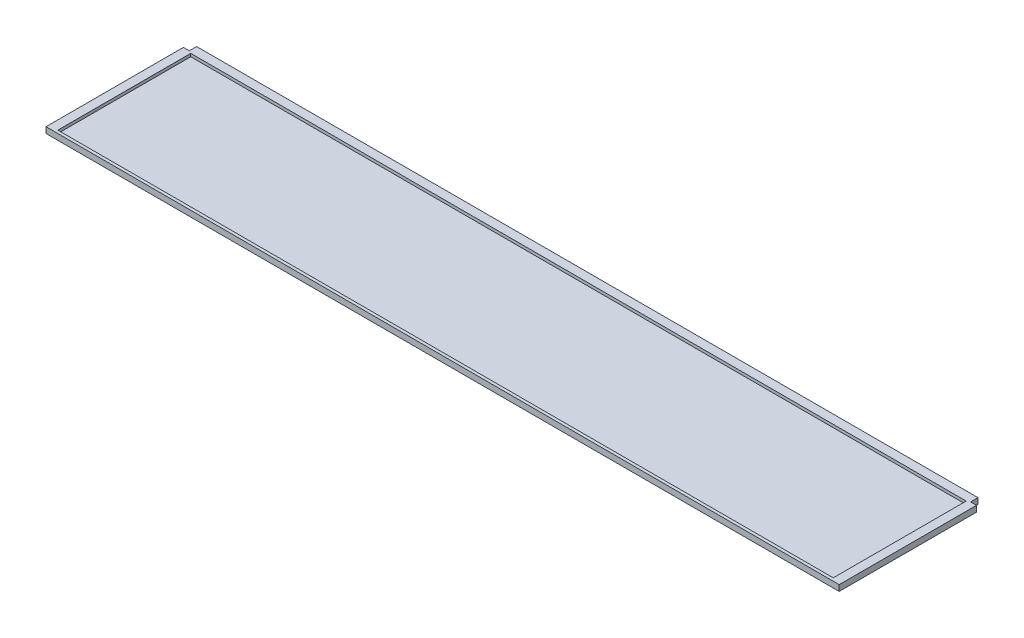
from build123d import *

# Parameters (mm, degrees)
SKETCH1_W           = 537
SKETCH1_H           = 98
BOSS_EXTRUDE1_DEPTH = 4
SKETCH2_W           = 525
SKETCH2_H           = 90
CUT_EXTRUDE1_DEPTH  = 2
SKETCH3_W           = 4
SKETCH3_H           = 5
CUT_EXTRUDE2_DEPTH  = 4


with BuildPart() as part:
    # Sketch1 → Boss-Extrude1 (new body)
    with BuildSketch(Plane(origin=(0, 0, 0), x_dir=(1, 0, 0), z_dir=(0, 1, 0))):
        with Locations((150.214854374, 11.968067941)):
            Rectangle(SKETCH1_W, SKETCH1_H)
    extrude(amount=BOSS_EXTRUDE1_DEPTH)

    # Sketch2 → Cut-Extrude1 (cut)
    with BuildSketch(Plane(origin=(0, 4, 0), x_dir=(1, 0, 0), z_dir=(0, 1, 0))):
        with Locations((150.214854374, 9.968067941)):
            Rectangle(SKETCH2_W, SKETCH2_H)
    extrude(amount=-CUT_EXTRUDE1_DEPTH, mode=Mode.SUBTRACT)

    # Sketch3 → Cut-Extrude2 (cut)
    with BuildSketch(Plane(origin=(0, 4, 0), x_dir=(1, 0, 0), z_dir=(0, 1, 0))):
        with Locations((-116.285145626, 58.468067941)):
            Rectangle(SKETCH3_W, SKETCH3_H)
        with Locations((416.714854374, 58.468067941)):
            Rectangle(SKETCH3_W, SKETCH3_H)
    extrude(amount=-CUT_EXTRUDE2_DEPTH, mode=Mode.SUBTRACT)


solid = part.part
